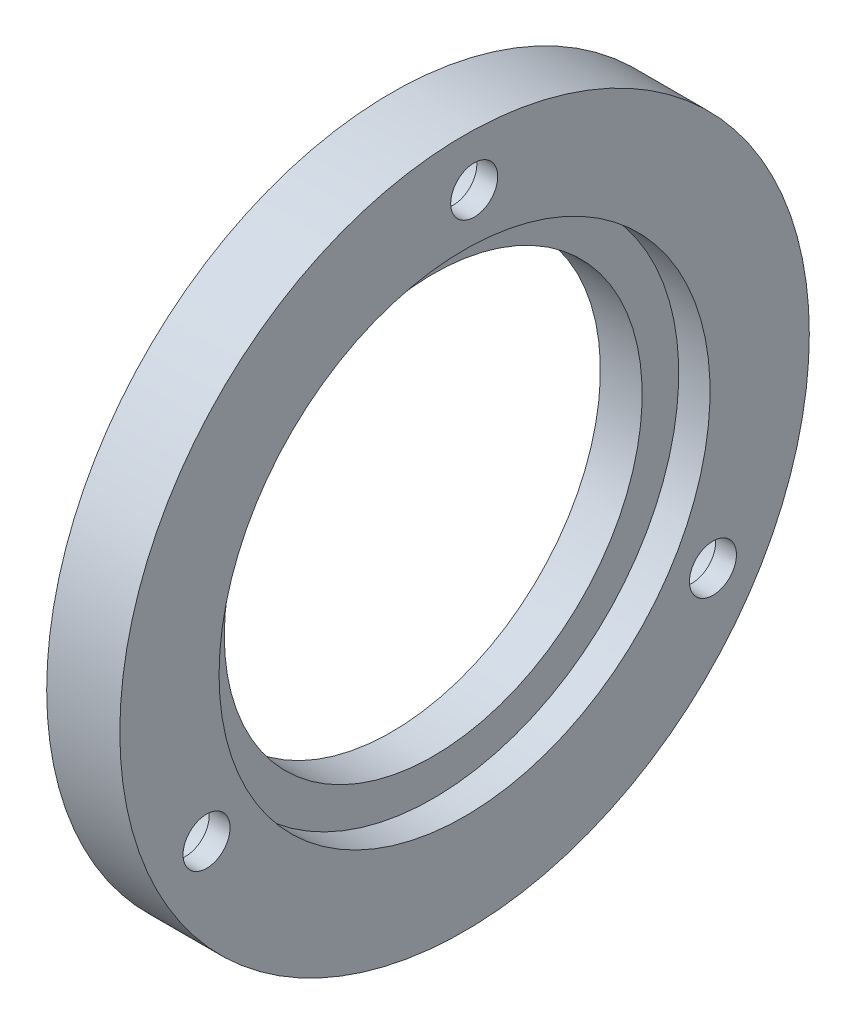
from build123d import *

# Parameters (mm, degrees)
CHAMBRAGE_POUR_VIS_T_TE_HEXAGONALE_M41_D           = 4.5
CHAMBRAGE_POUR_VIS_T_TE_HEXAGONALE_M41_CBORE_D     = 8
CHAMBRAGE_POUR_VIS_T_TE_HEXAGONALE_M41_CBORE_DEPTH = 5
R_P_TITION_CIRCULAIRE1_COUNT                       = 3


with BuildPart() as part:
    # Esquisse1 → Révolution1 (revolve)
    with BuildSketch(Plane.XY, mode=Mode.PRIVATE) as r_volution1_sk:
        Polygon((0, 20), (0, 33), (7, 33), (7, 23.5), (4, 23.5), (4, 20), align=None)
    revolve(r_volution1_sk.sketch.rotate(Axis((-15.138230384, 0, 0), (1, 0, 0)), 90), axis=Axis((-15.138230384, 0, 0), (1, 0, 0)))

    # Chambrage pour vis à tête hexagonale M41 (through all)
    with Locations(Plane(origin=(0, 27.984819093, -0.921900388), x_dir=(0, 0, -1), z_dir=(-1, 0, 0))):
        with Locations((0, 0)):
            chambrage_pour_vis_t_te_hexagonale_m41 = CounterBoreHole(CHAMBRAGE_POUR_VIS_T_TE_HEXAGONALE_M41_D / 2, CHAMBRAGE_POUR_VIS_T_TE_HEXAGONALE_M41_CBORE_D / 2, CHAMBRAGE_POUR_VIS_T_TE_HEXAGONALE_M41_CBORE_DEPTH)

    # Répétition circulaire1: Chambrage pour vis à tête hexagonale M41 ×3 about axis
    r_p_tition_circulaire1_axis = Axis((0, 0, 0), (1, 0, 0))
    for i in range(1, R_P_TITION_CIRCULAIRE1_COUNT):
        add(chambrage_pour_vis_t_te_hexagonale_m41.rotate(r_p_tition_circulaire1_axis, i * 360 / R_P_TITION_CIRCULAIRE1_COUNT), mode=Mode.SUBTRACT)


solid = part.part
